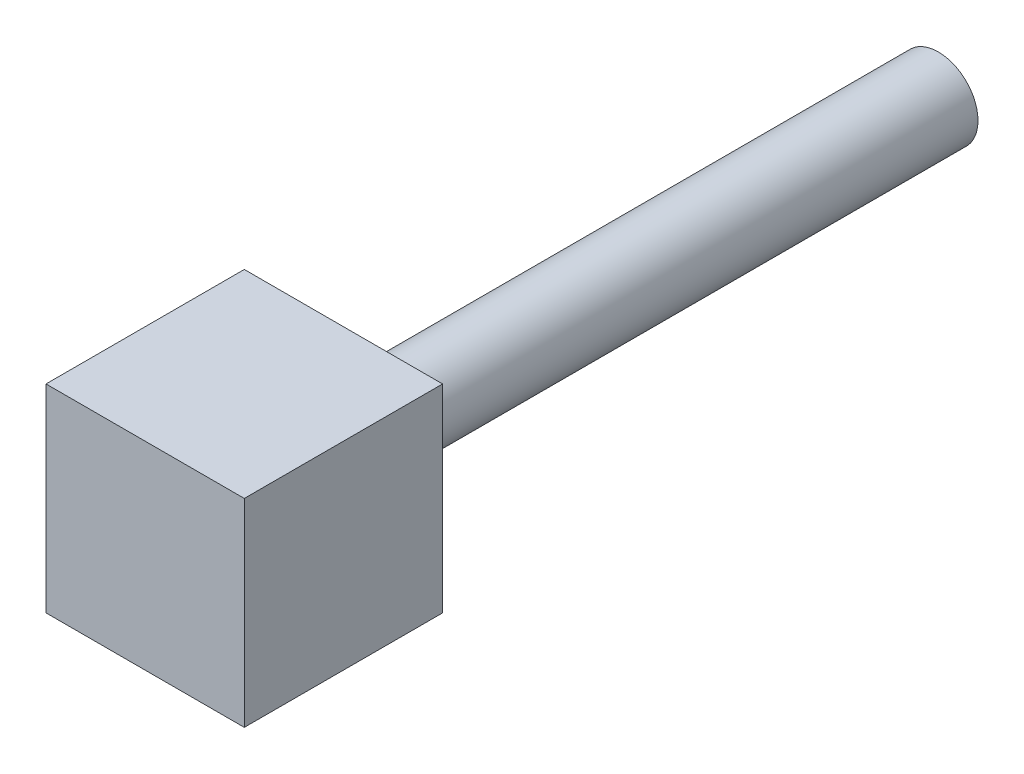
from build123d import *

# Parameters (mm, degrees)
SKETCH1_W           = 60
SKETCH1_H           = 4
SKETCH4_W           = 20
SKETCH4_H           = 20
BOSS_EXTRUDE2_DEPTH = 20


with BuildPart() as part:
    # Sketch1 → Revolve1 (revolve)
    with BuildSketch(Plane(origin=(0, 0, 0), x_dir=(0, 0, -1), z_dir=(1, 0, 0)), mode=Mode.PRIVATE) as revolve1_sk:
        with Locations((-15.215395953, 3.196078431)):
            Rectangle(SKETCH1_W, SKETCH1_H)
    revolve(revolve1_sk.sketch.rotate(Axis((0, 1.196078431, 45.215395953), (0, 0, -1)), 90), axis=Axis((0, 1.196078431, 45.215395953), (0, 0, -1)))

    # Sketch4 → Boss-Extrude2 (add)
    with BuildSketch(Plane.XY.offset(45.215395953)):
        with Locations((0, 1.196078431)):
            Rectangle(SKETCH4_W, SKETCH4_H)
    extrude(amount=BOSS_EXTRUDE2_DEPTH)


solid = part.part
